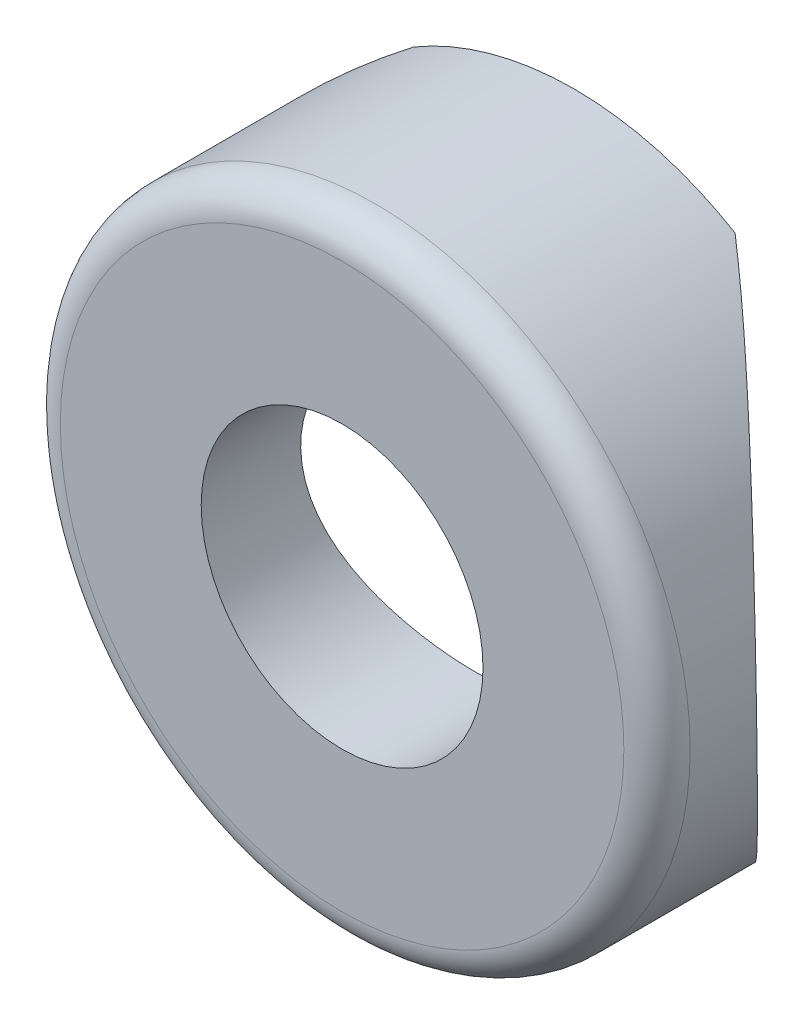
from build123d import *

# Parameters (mm, degrees)
SKETCH_1_R               = 9.5
SKETCH_1_R_2             = 4.25
EXTRUDE_1_DEPTH          = 7
CUT_EXTRUDE_1_DEPTH      = 16.149257408
CUT_EXTRUDE_1_DEPTH_BACK = 16.149257408
SKETCH_3_R               = 10
FILLET_1_R               = 1


with BuildPart() as part:
    # Эскиз1 → Бобышка-Вытянуть1 (new body)
    with BuildSketch(Plane.XY):
        Circle(SKETCH_1_R)
        Circle(SKETCH_1_R_2, mode=Mode.SUBTRACT)
    extrude(amount=EXTRUDE_1_DEPTH)

    # Эскиз3 → Вырез-Вытянуть1 (cut, two sides: drawn at the far end of the back side and taken through both)
    with BuildSketch(Plane(origin=(0, 0, 0), x_dir=(0, 0, -1), z_dir=(1, 0, 0)).offset(-CUT_EXTRUDE_1_DEPTH_BACK)):
        with Locations((6, 0.166135782)):
            Circle(SKETCH_3_R)
    extrude(amount=CUT_EXTRUDE_1_DEPTH + CUT_EXTRUDE_1_DEPTH_BACK, mode=Mode.SUBTRACT)

    # Скругление1
    fillet_1_edges = [part.edges().sort_by_distance(p)[0] for p in [
        (-9.5, 0, 7),
    ]]
    fillet(fillet_1_edges, radius=FILLET_1_R)


solid = part.part
